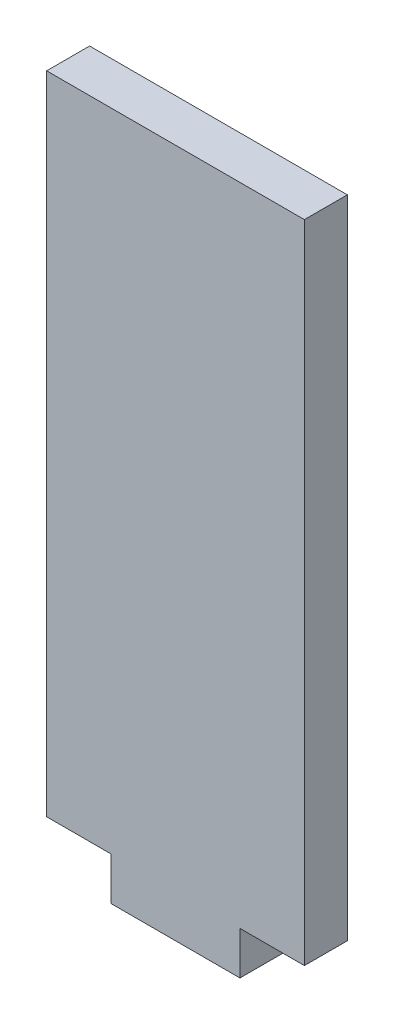
from build123d import *

# Parameters (mm, degrees)
EXTRUDE_1_DEPTH = 2


with BuildPart() as part:
    # 草图1 → 凸台-拉伸1 (new body)
    with BuildSketch(Plane.XY):
        Polygon((-6, 0), (-6, 15), (-6, 30.078774409), (6, 30.078774409), (6, 15), (6, 0), (3, 0), (3, -2), (-3, -2), (-3, 0), align=None)
    extrude(amount=EXTRUDE_1_DEPTH)


solid = part.part
